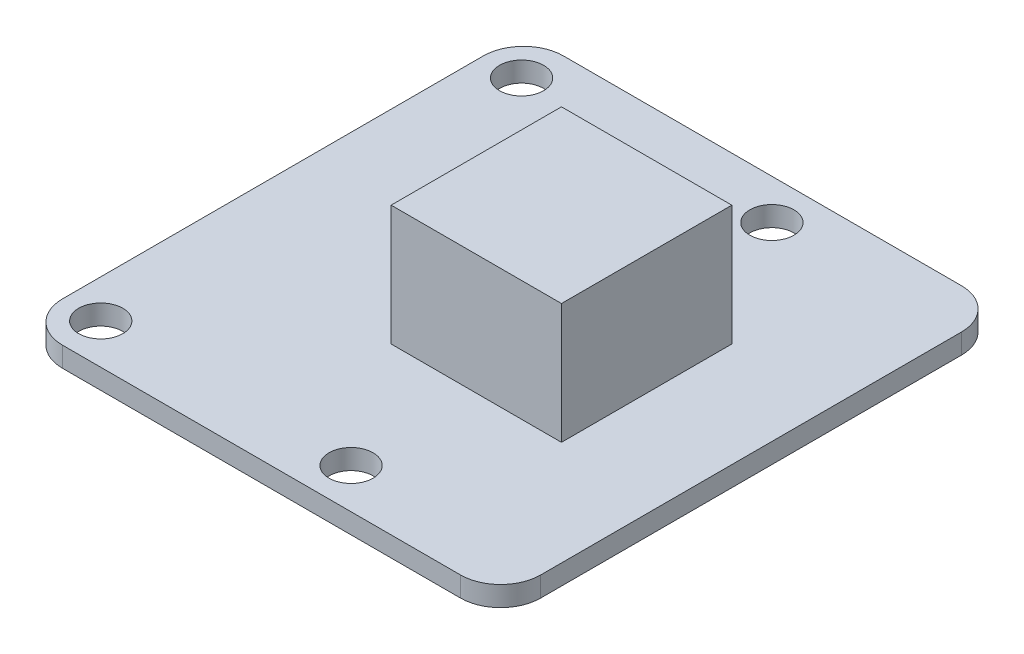
from build123d import *

# Parameters (mm, degrees)
SKETCH1_W           = 23.862
SKETCH1_H           = 25
SKETCH1_R           = 1.1
BOSS_EXTRUDE1_DEPTH = 1
FILLET1_R           = 2
SKETCH2_W           = 8.5
SKETCH2_H           = 8.5
BOSS_EXTRUDE2_DEPTH = 6


with BuildPart() as part:
    # Sketch1 → Boss-Extrude1 (new body)
    with BuildSketch(Plane(origin=(0, 0, 0), x_dir=(1, 0, 0), z_dir=(0, 1, 0))):
        Rectangle(SKETCH1_W, SKETCH1_H)
        with Locations(Location((-10.02204, 10.5, 0), (0, 0, 270))):
            Circle(SKETCH1_R, mode=Mode.SUBTRACT)
        with Locations(Location((2.469, 10.5, 0), (0, 0, 270))):
            Circle(SKETCH1_R, mode=Mode.SUBTRACT)
        with Locations(Location((2.469, -10.5, 0), (0, 0, 90))):
            Circle(SKETCH1_R, mode=Mode.SUBTRACT)
        with Locations(Location((-10.02204, -10.5, 0), (0, 0, 90))):
            Circle(SKETCH1_R, mode=Mode.SUBTRACT)
    extrude(amount=BOSS_EXTRUDE1_DEPTH)

    # Fillet1
    fillet1_edges = [part.edges().sort_by_distance(p)[0] for p in [
        (11.931, 0.5, 12.5),
        (-11.931, 0.5, 12.5),
        (-11.931, 0.5, -12.5),
        (11.931, 0.5, -12.5),
    ]]
    fillet(fillet1_edges, radius=FILLET1_R)

    # Sketch2 → Boss-Extrude2 (add)
    with BuildSketch(Plane(origin=(0, 1, 0), x_dir=(1, 0, 0), z_dir=(0, 1, 0))):
        with Locations((2.469, 0)):
            Rectangle(SKETCH2_W, SKETCH2_H)
    extrude(amount=BOSS_EXTRUDE2_DEPTH)


solid = part.part
